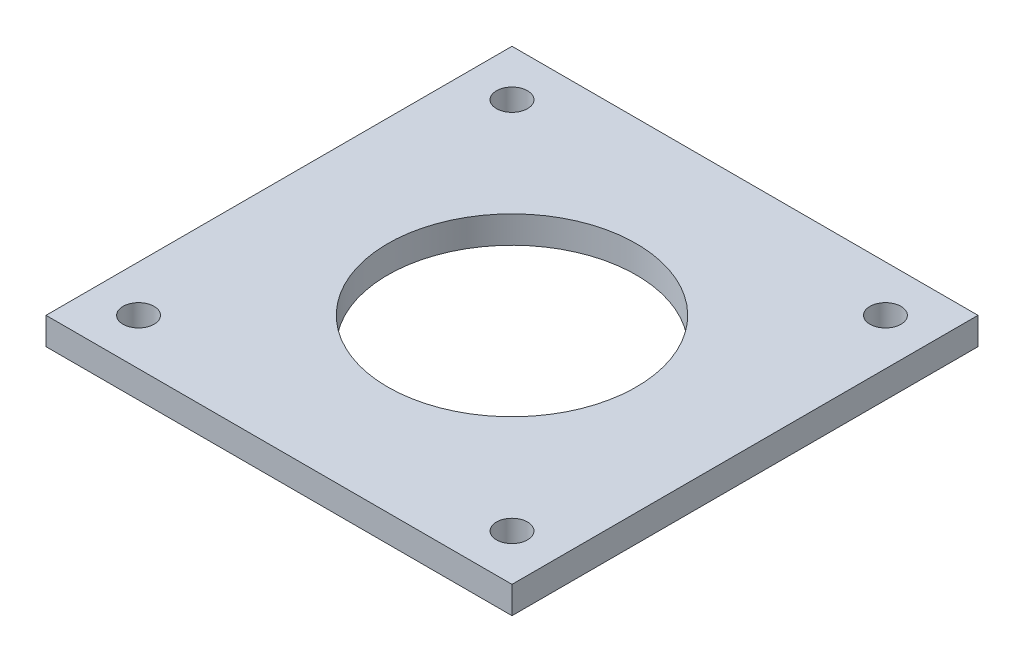
from build123d import *

# Parameters (mm, degrees)
SKETCH1_W           = 60
SKETCH1_H           = 60
SKETCH1_R           = 16
SKETCH1_R_2         = 2
BOSS_EXTRUDE1_DEPTH = 3.5


with BuildPart() as part:
    # Sketch1 → Boss-Extrude1 (new body)
    with BuildSketch(Plane(origin=(0, 0, 0), x_dir=(1, 0, 0), z_dir=(0, 1, 0))):
        Rectangle(SKETCH1_W, SKETCH1_H)
        with Locations(Location((0, 0, 0), (0, 0, 270))):
            Circle(SKETCH1_R, mode=Mode.SUBTRACT)
        with Locations(Location((24.04163056, -24.04163056, 0), (0, 0, 270))):
            Circle(SKETCH1_R_2, mode=Mode.SUBTRACT)
        with Locations(Location((24.04163056, 24.04163056, 0), (0, 0, 270))):
            Circle(SKETCH1_R_2, mode=Mode.SUBTRACT)
        with Locations(Location((-24.04163056, 24.04163056, 0), (0, 0, 270))):
            Circle(SKETCH1_R_2, mode=Mode.SUBTRACT)
        with Locations(Location((-24.04163056, -24.04163056, 0), (0, 0, 270))):
            Circle(SKETCH1_R_2, mode=Mode.SUBTRACT)
    extrude(amount=BOSS_EXTRUDE1_DEPTH)


solid = part.part
